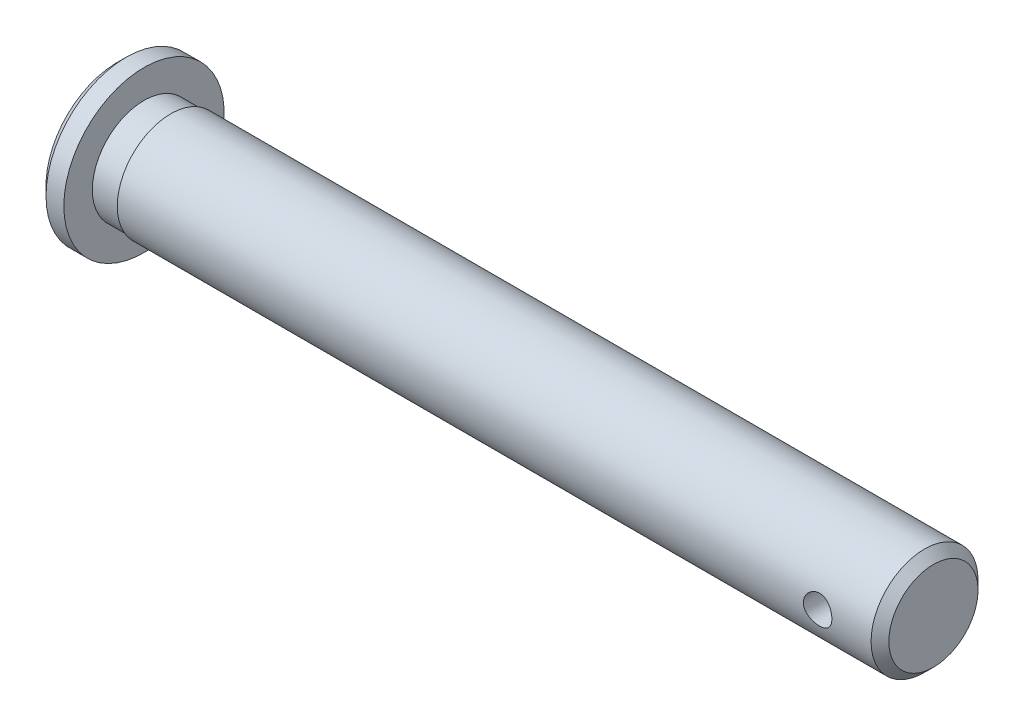
from build123d import *

# Parameters (mm, degrees)
SKETCH2_R          = 0.8
CUT_EXTRUDE1_DEPTH = 46.15517689
CHAMFER1_SIZE      = 0.5


with BuildPart() as part:
    # Sketch1 → Revolve1 (revolve)
    with BuildSketch(Plane.XY, mode=Mode.PRIVATE) as revolve1_sk:
        Polygon((-1.5, 0), (-1.5, 4.5), (0, 4.5), (0, 2.9), (1.5, 2.9), (1.5, 3), (44.3, 3), (44.3, 0), align=None)
    revolve(revolve1_sk.sketch.rotate(Axis((0, 0, 0), (1, 0, 0)), 90), axis=Axis((0, 0, 0), (1, 0, 0)))

    # Sketch2 → Cut-Extrude1 (cut, through all)
    with BuildSketch(Plane.XY.offset(3)):
        with Locations((40.8, 0)):
            Circle(SKETCH2_R)
    extrude(amount=-CUT_EXTRUDE1_DEPTH, mode=Mode.SUBTRACT)

    # Chamfer1
    chamfer1_edges = [part.edges().sort_by_distance(p)[0] for p in [
        (44.3, 0, -3),
        (-1.5, 0, -4.5),
    ]]
    chamfer(chamfer1_edges, length=CHAMFER1_SIZE)


solid = part.part
